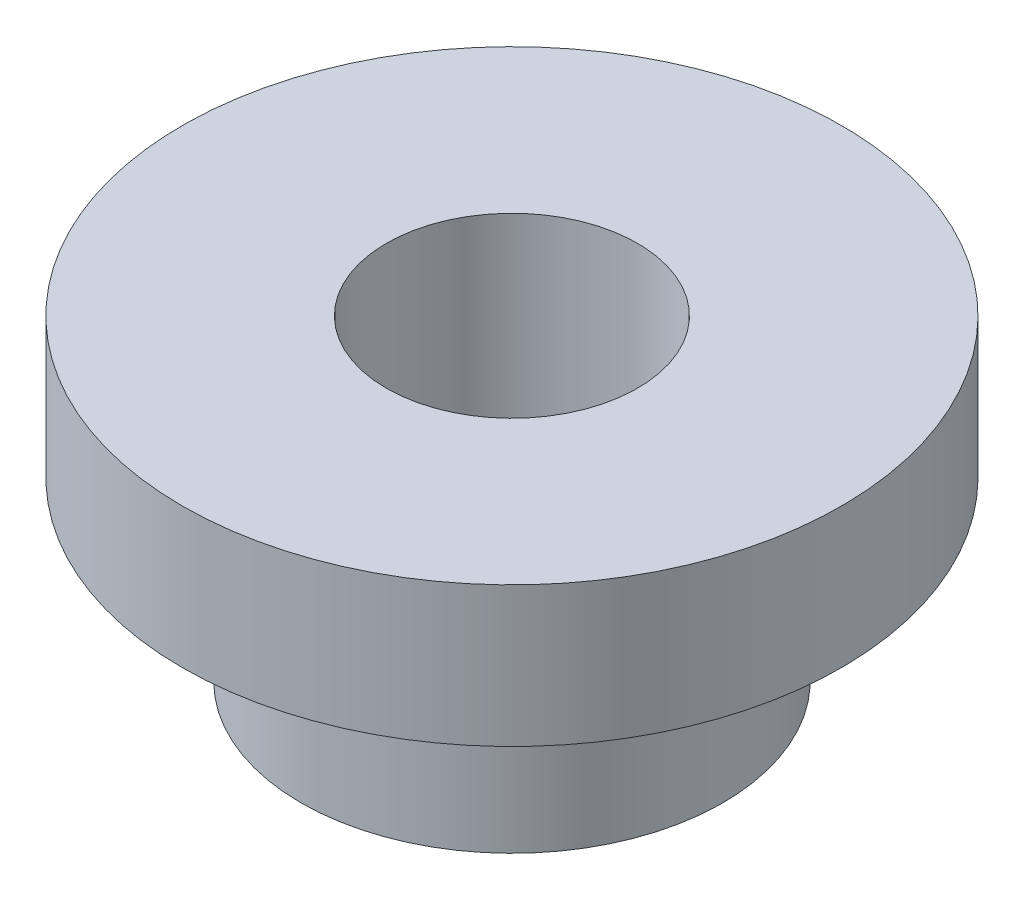
from build123d import *


with BuildPart() as part:
    # Sketch2 → Revolve1 (revolve)
    with BuildSketch(Plane.XY, mode=Mode.PRIVATE) as revolve1_sk:
        Polygon((4.7625, -6), (4.7625, 6), (12.5, 6), (12.5, 0.69), (8, 0.69), (8, -6), align=None)
    revolve(revolve1_sk.sketch.rotate(Axis((0, 6, 0), (0, -1, 0)), 90), axis=Axis((0, 6, 0), (0, -1, 0)))


solid = part.part
